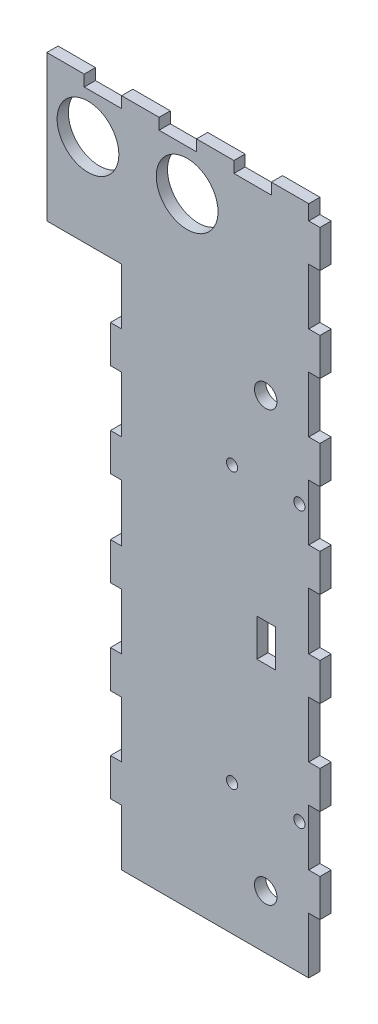
from build123d import *

# Parameters (mm, degrees)
ESQUISSE2_R        = 1.5
ESQUISSE2_R_2      = 3
ESQUISSE2_R_3      = 8.25
ESQUISSE2_W        = 5
ESQUISSE2_H        = 10
BOSS_EXTRU_1_DEPTH = 3


with BuildPart() as part:
    # Esquisse2 → Boss.-Extru.1 (new body)
    with BuildSketch(Plane.XY):
        Polygon((-71.711544081, -86.276689775), (-71.711544081, -71.276689775), (-74.711544081, -71.276689775), (-74.711544081, -61.276689775), (-71.711544081, -61.276689775), (-71.711544081, -46.276689775), (-74.711544081, -46.276689775), (-74.711544081, -36.276689775), (-71.711544081, -36.276689775), (-71.711544081, -21.276689775), (-74.711544081, -21.276689775), (-74.711544081, -11.276689775), (-71.711544081, -11.276689775), (-71.711544081, 3.970120669), (-74.711544081, 3.970120669), (-74.711544081, 13.970120669), (-71.711544081, 13.970120669), (-71.711544081, 28.970120669), (-74.711544081, 28.970120669), (-74.711544081, 38.970120669), (-71.711544081, 38.970120669), (-71.711544081, 53.970120669), (-91.711544081, 53.970120669), (-91.711544081, 92.970120669), (-81.711544081, 92.970120669), (-81.711544081, 89.970120669), (-71.711544081, 89.970120669), (-71.711544081, 92.970120669), (-61.711544081, 92.970120669), (-61.711544081, 89.970120669), (-51.711544081, 89.970120669), (-51.711544081, 92.970120669), (-41.711544081, 92.970120669), (-41.711544081, 89.970120669), (-31.711544081, 89.970120669), (-31.711544081, 92.970120669), (-21.711544081, 92.970120669), (-21.711544081, 88.970120669), (-18.711544081, 88.970120669), (-18.711544081, 78.970120669), (-21.711544081, 78.970120669), (-21.711544081, 63.970120669), (-18.711544081, 63.970120669), (-18.711544081, 53.970120669), (-21.711544081, 53.970120669), (-21.711544081, 38.970120669), (-18.711544081, 38.970120669), (-18.711544081, 28.970120669), (-21.711544081, 28.970120669), (-21.711544081, 13.970120669), (-18.711544081, 13.970120669), (-18.711544081, 3.970120669), (-21.711544081, 3.970120669), (-21.711544081, -11.276689775), (-18.711544081, -11.276689775), (-18.711544081, -21.276689775), (-21.711544081, -21.276689775), (-21.711544081, -36.276689775), (-18.711544081, -36.276689775), (-18.711544081, -46.276689775), (-21.711544081, -46.276689775), (-21.711544081, -61.276689775), (-18.711544081, -61.276689775), (-18.711544081, -71.276689775), (-21.711544081, -71.276689775), (-21.711544081, -86.276689775), align=None)
        with Locations((-42.211544081, -51.276689775)):
            Circle(ESQUISSE2_R, mode=Mode.SUBTRACT)
        with Locations((-24.211544081, -51.276689775)):
            Circle(ESQUISSE2_R, mode=Mode.SUBTRACT)
        with Locations(Location((-33.211544081, 42.823310225, 0), (0, 0, 180))):
            Circle(ESQUISSE2_R_2, mode=Mode.SUBTRACT)
        with Locations(Location((-42.211544081, 22.223310225, 0), (0, 0, 180))):
            Circle(ESQUISSE2_R, mode=Mode.SUBTRACT)
        with Locations(Location((-24.211544081, 22.223310225, 0), (0, 0, 180))):
            Circle(ESQUISSE2_R, mode=Mode.SUBTRACT)
        with Locations((-80.711544081, 78.970120669)):
            Circle(ESQUISSE2_R_3, mode=Mode.SUBTRACT)
        with Locations((-54.211544081, 78.970120669)):
            Circle(ESQUISSE2_R_3, mode=Mode.SUBTRACT)
        with Locations((-33.211544081, -71.876689775)):
            Circle(ESQUISSE2_R_2, mode=Mode.SUBTRACT)
        with Locations((-33.078903677, -14.419560471)):
            Rectangle(ESQUISSE2_W, ESQUISSE2_H, mode=Mode.SUBTRACT)
    extrude(amount=BOSS_EXTRU_1_DEPTH)


solid = part.part
